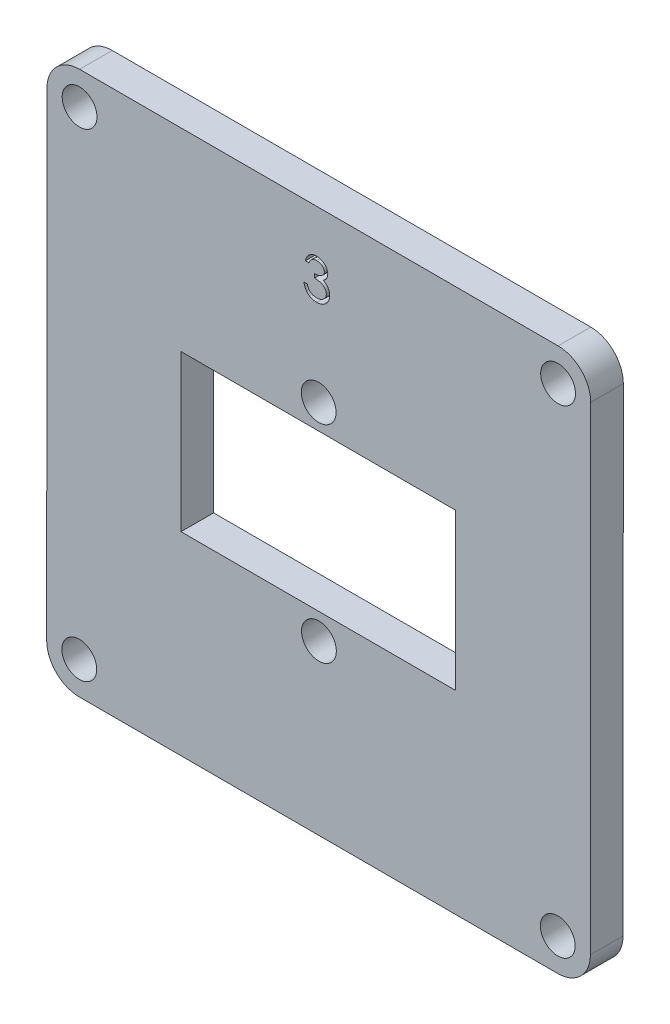
from build123d import *

# Parameters (mm, degrees)
SKETCH_1_R          = 1.6
EXTRUDE_1_DEPTH     = 3
CUT_EXTRUDE_1_DEPTH = 1


with BuildPart() as part:
    # 草图1 → 凸台-拉伸1 (new body)
    with BuildSketch(Plane.XY.offset(3)):
        with BuildLine():
            Line((291.102941136, 60.850305737), (291.076707349, 16.850305738))
            ThreePointArc((291.076707349, 16.850305738), (291.954101097, 14.728512603), (294.07484648, 13.848589358))
            Line((294.07484648, 13.848589358), (338.074844131, 13.822355573))
            ThreePointArc((338.074844131, 13.822355573), (340.196637266, 14.699749321), (341.07656051, 16.820494704))
            Line((341.07656051, 16.820494704), (341.102794297, 60.820495366))
            ThreePointArc((341.102794297, 60.820495366), (340.22540099, 62.942287436), (338.104656671, 63.822210239))
            Line((338.104656671, 63.822210239), (294.104656671, 63.848444025))
            ThreePointArc((294.104656671, 63.848444025), (291.982864133, 62.971050524), (291.102941136, 60.850305737))
        make_face()
        with Locations(Location((338.076632755, 16.822283328, 0), (0, 0, 180))):
            Circle(SKETCH_1_R, mode=Mode.SUBTRACT)
        with Locations(Location((294.102868048, 60.848517113, 0), (0, 0, 180))):
            Circle(SKETCH_1_R, mode=Mode.SUBTRACT)
        with Locations(Location((338.102868048, 60.822283989, 0), (0, 0, 180))):
            Circle(SKETCH_1_R, mode=Mode.SUBTRACT)
        with Locations(Location((294.076635104, 16.848517113, 0), (0, 0, 180))):
            Circle(SKETCH_1_R, mode=Mode.SUBTRACT)
        with Locations(Location((316.111204471, 29.315652621, 0), (0, 0, 180))):
            Circle(SKETCH_1_R, mode=Mode.SUBTRACT)
        with Locations(Location((316.090486738, 48.315652621, 0), (0, 0, 180))):
            Circle(SKETCH_1_R, mode=Mode.SUBTRACT)
        Polygon((303.43545239, 46.035704845), (328.682343893, 46.020652083), (328.673787658, 31.669910181), (303.426896156, 31.684962944), align=None, mode=Mode.SUBTRACT)
    extrude(amount=-EXTRUDE_1_DEPTH)

    # 草图2 → 切除-拉伸1 (cut)
    with BuildSketch(Plane.XY.offset(3)):
        with BuildLine():
            Line((315.174630784, 58.972726271), (314.86052822, 58.972726271))
            add(Edge.make_bspline(
                [(314.86052822, 58.972726271), (314.869037771, 59.007958755), (314.885673246, 59.07683538), (314.92037082, 59.17524264), (314.958170075, 59.268366162), (315.003559179, 59.354462236), (315.053067934, 59.435261138), (315.109790655, 59.508930263), (315.171110378, 59.577343228), (315.238935327, 59.638056466), (315.310063989, 59.693034195), (315.385498608, 59.739909252), (315.463721502, 59.780233405), (315.545274635, 59.813453637), (315.630400807, 59.838479161), (315.71833043, 59.856635966), (315.80929393, 59.868427081), (315.871041521, 59.869577844), (315.902395207, 59.870162169)],
                knots=[0, 0, 0, 0, 1.162005537, 2.271625781, 3.343758855, 4.383309926, 5.390229558, 6.379919256, 7.361854164, 8.333198761, 9.295911338, 10.242430842, 11.177959212, 12.116337295, 13.062827104, 14.020064771, 14.994644689, 16, 16, 16, 16], degree=3))
            add(Edge.make_bspline(
                [(315.902395207, 59.870162169), (315.948077949, 59.868782938), (316.03844696, 59.866054563), (316.171210007, 59.841140127), (316.299236826, 59.801714994), (316.421126074, 59.747241267), (316.534344507, 59.680053954), (316.635080693, 59.600089217), (316.721969204, 59.508889915), (316.794863582, 59.408157351), (316.851938581, 59.300501842), (316.894024954, 59.189701685), (316.919646635, 59.076019713), (316.922967192, 58.999262434), (316.924630784, 58.960807201)],
                knots=[0, 0, 0, 0, 1.083050992, 2.142477498, 3.193116406, 4.255571735, 5.30263384, 6.308962982, 7.297363603, 8.282367274, 9.249857812, 10.179914175, 11.08814088, 12, 12, 12, 12], degree=3))
            add(Edge.make_bspline(
                [(316.924630784, 58.960807201), (316.923467193, 58.923800406), (316.921190226, 58.851383852), (316.90185652, 58.745662354), (316.869320257, 58.646020754), (316.824250495, 58.552039592), (316.765908945, 58.464314752), (316.695236248, 58.382648861), (316.611733586, 58.306679703), (316.548454648, 58.26316023), (316.515876778, 58.240755117)],
                knots=[0, 0, 0, 0, 1.024540389, 2.004866551, 2.965041327, 3.920577974, 4.882998113, 5.874504559, 6.905732034, 8, 8, 8, 8], degree=3))
            add(Edge.make_bspline(
                [(316.515876778, 58.240755117), (316.553108532, 58.222776946), (316.626875406, 58.187156988), (316.727425936, 58.117301231), (316.818703811, 58.036644883), (316.86960753, 57.97370223), (316.895183669, 57.942077233)],
                knots=[0, 0, 0, 0, 1.015518401, 2.012035669, 3.001164323, 4, 4, 4, 4], degree=3))
            add(Edge.make_bspline(
                [(316.895183669, 57.942077233), (316.912025011, 57.919019481), (316.945431907, 57.873281565), (316.986667441, 57.799745139), (317.024076555, 57.725393649), (317.053226774, 57.648234243), (317.075800641, 57.56916123), (317.091936674, 57.488038834), (317.101960814, 57.404800811), (317.103396366, 57.348488331), (317.104117964, 57.320182201)],
                knots=[0, 0, 0, 0, 1.025084078, 2.033381695, 3.024893161, 4.013698104, 4.991890475, 5.976764909, 6.982997093, 8, 8, 8, 8], degree=3))
            add(Edge.make_bspline(
                [(317.104117964, 57.320182201), (317.10232345, 57.27117248), (317.098742868, 57.173383678), (317.066738794, 57.028908956), (317.017125553, 56.887683454), (316.946668617, 56.752608615), (316.860801108, 56.626228234), (316.758643784, 56.513151925), (316.641357376, 56.41595332), (316.510551727, 56.334743092), (316.368834598, 56.26982517), (316.217259006, 56.224767727), (316.058008952, 56.195421727), (315.948801655, 56.192274859), (315.893280624, 56.190674989)],
                knots=[0, 0, 0, 0, 0.955779014, 1.907060117, 2.875433937, 3.871313158, 4.872415639, 5.851225146, 6.836215519, 7.83643374, 8.849228613, 9.86973379, 10.916971861, 12, 12, 12, 12], degree=3))
            add(Edge.make_bspline(
                [(315.893280624, 56.190674989), (315.855861324, 56.191543202), (315.782232618, 56.193251557), (315.67398912, 56.204930158), (315.570667421, 56.226260163), (315.472127823, 56.254963468), (315.378282786, 56.291355211), (315.289418681, 56.336673909), (315.204988788, 56.389985411), (315.125789837, 56.451918998), (315.051831269, 56.521200338), (314.985078545, 56.599059348), (314.924418752, 56.684056752), (314.871476113, 56.777179808), (314.82383916, 56.877225066), (314.784658204, 56.985473564), (314.750172635, 57.100957586), (314.734139171, 57.181435326), (314.725912835, 57.222726271)],
                knots=[0, 0, 0, 0, 1.048658725, 2.063410685, 3.046034179, 4.001477787, 4.936774919, 5.862367409, 6.792675028, 7.730719943, 8.675894397, 9.627829632, 10.600096036, 11.597688215, 12.626045268, 13.701542398, 14.82072376, 16, 16, 16, 16], degree=3))
            Line((314.725912835, 57.222726271), (315.040015399, 57.222726271))
            add(Edge.make_bspline(
                [(315.040015399, 57.222726271), (315.048198691, 57.195777258), (315.064115904, 57.143359086), (315.091210202, 57.067918781), (315.122078474, 56.998760727), (315.155193032, 56.935377606), (315.189971478, 56.877145203), (315.228886403, 56.825603334), (315.269055549, 56.778488132), (315.299334902, 56.75194352), (315.314154021, 56.738952233)],
                knots=[0, 0, 0, 0, 1.198163088, 2.33053128, 3.407730985, 4.417276592, 5.372219308, 6.28897303, 7.162600585, 8, 8, 8, 8], degree=3))
            add(Edge.make_bspline(
                [(315.314154021, 56.738952233), (315.333750598, 56.723843899), (315.372883261, 56.693673867), (315.436651492, 56.655172239), (315.503716378, 56.621811213), (315.575531052, 56.596327518), (315.650545823, 56.574749857), (315.729973188, 56.560629338), (315.813112405, 56.550941166), (315.869880168, 56.550086235), (315.898889598, 56.549649348)],
                knots=[0, 0, 0, 0, 0.946170439, 1.889420265, 2.845303464, 3.807233317, 4.801018734, 5.828864929, 6.890507805, 8, 8, 8, 8], degree=3))
            add(Edge.make_bspline(
                [(315.898889598, 56.549649348), (315.931643101, 56.550265253), (315.995689748, 56.551469603), (316.089144607, 56.56254531), (316.178052055, 56.578675723), (316.26142498, 56.603588706), (316.340355488, 56.634369558), (316.413737137, 56.673017963), (316.482533244, 56.718362685), (316.545862649, 56.769901843), (316.602808157, 56.826323338), (316.65294767, 56.885336409), (316.695572331, 56.946692239), (316.729955909, 57.01073036), (316.75710646, 57.077185589), (316.77558966, 57.146244418), (316.788441175, 57.217341684), (316.789487788, 57.265670653), (316.790015399, 57.290033964)],
                knots=[0, 0, 0, 0, 1.217147791, 2.380027433, 3.494444702, 4.572153297, 5.609568379, 6.639424714, 7.649109417, 8.668170816, 9.669597737, 10.625200337, 11.543417969, 12.441394052, 13.322311151, 14.205496177, 15.095365482, 16, 16, 16, 16], degree=3))
            add(Edge.make_bspline(
                [(316.790015399, 57.290033964), (316.788485098, 57.322645302), (316.785432109, 57.387705711), (316.76212353, 57.483423285), (316.723784666, 57.575646697), (316.670112154, 57.662802487), (316.604776426, 57.743578389), (316.528411519, 57.815649871), (316.440383291, 57.875119963), (316.359363422, 57.916208619), (316.287598265, 57.944245694), (316.226182881, 57.962920659), (316.157426277, 57.978734314), (316.082159928, 57.993446586), (315.999816712, 58.005967934), (315.910486274, 58.01640975), (315.814150512, 58.024764791), (315.747459346, 58.028495886), (315.713092323, 58.030418579)],
                knots=[0, 0, 0, 0, 1.07054697, 2.135767047, 3.216561865, 4.33974944, 5.486079747, 6.621378074, 7.775625952, 8.963672916, 9.598146892, 10.304877434, 11.070270905, 11.915000392, 12.823868403, 13.805723172, 14.86925407, 16, 16, 16, 16], degree=3))
            Line((315.713092323, 58.030418579), (315.713092323, 58.389392938))
            add(Edge.make_bspline(
                [(315.713092323, 58.389392938), (315.756393488, 58.390127742), (315.841209835, 58.391567042), (315.96510414, 58.408975052), (316.083577452, 58.43305568), (316.194004194, 58.469940872), (316.294652907, 58.512781169), (316.381972509, 58.562633379), (316.454739656, 58.618048128), (316.512600728, 58.679880737), (316.556129957, 58.746195785), (316.587956754, 58.815312442), (316.60675708, 58.887836503), (316.609266747, 58.937331171), (316.61052822, 58.962209444)],
                knots=[0, 0, 0, 0, 1.321986639, 2.589447074, 3.816329219, 5.01088745, 6.139805852, 7.153945165, 8.075214402, 8.924034688, 9.728124013, 10.488707548, 11.240355623, 12, 12, 12, 12], degree=3))
            add(Edge.make_bspline(
                [(316.61052822, 58.962209444), (316.610113809, 58.980487189), (316.609289358, 59.016849897), (316.59889208, 59.069974965), (316.583268039, 59.121475911), (316.56178831, 59.171133721), (316.533038111, 59.218603995), (316.498632125, 59.264291444), (316.457664024, 59.307935223), (316.410718577, 59.348615543), (316.360306772, 59.38738478), (316.305056997, 59.420298417), (316.246635123, 59.448443479), (316.184976468, 59.471652981), (316.119880938, 59.489112269), (316.05165438, 59.501648111), (315.980166696, 59.509485766), (315.931394964, 59.510614181), (315.906601938, 59.51118781)],
                knots=[0, 0, 0, 0, 0.884392785, 1.759457502, 2.611959086, 3.489218968, 4.37281399, 5.2945488, 6.255912374, 7.266815255, 8.301784654, 9.332968512, 10.37626691, 11.440494194, 12.520033166, 13.637162961, 14.798855837, 16, 16, 16, 16], degree=3))
            add(Edge.make_bspline(
                [(315.906601938, 59.51118781), (315.86675027, 59.509796448), (315.788910694, 59.507078794), (315.676695777, 59.483275781), (315.572376443, 59.445297697), (315.492637776, 59.399964678), (315.433755202, 59.355214244), (315.391678264, 59.316131858), (315.350357753, 59.272699034), (315.312512076, 59.222240659), (315.2742381, 59.168173868), (315.239393538, 59.107750187), (315.205533846, 59.042545793), (315.185131296, 58.996450158), (315.174630784, 58.972726271)],
                knots=[0, 0, 0, 0, 1.472543308, 2.876219568, 4.221790263, 5.565193594, 6.249813518, 6.953379497, 7.687249741, 8.463570142, 9.283606569, 10.136032583, 11.040678096, 12, 12, 12, 12], degree=3))
        make_face()
    extrude(amount=-CUT_EXTRUDE_1_DEPTH, mode=Mode.SUBTRACT)


solid = part.part
